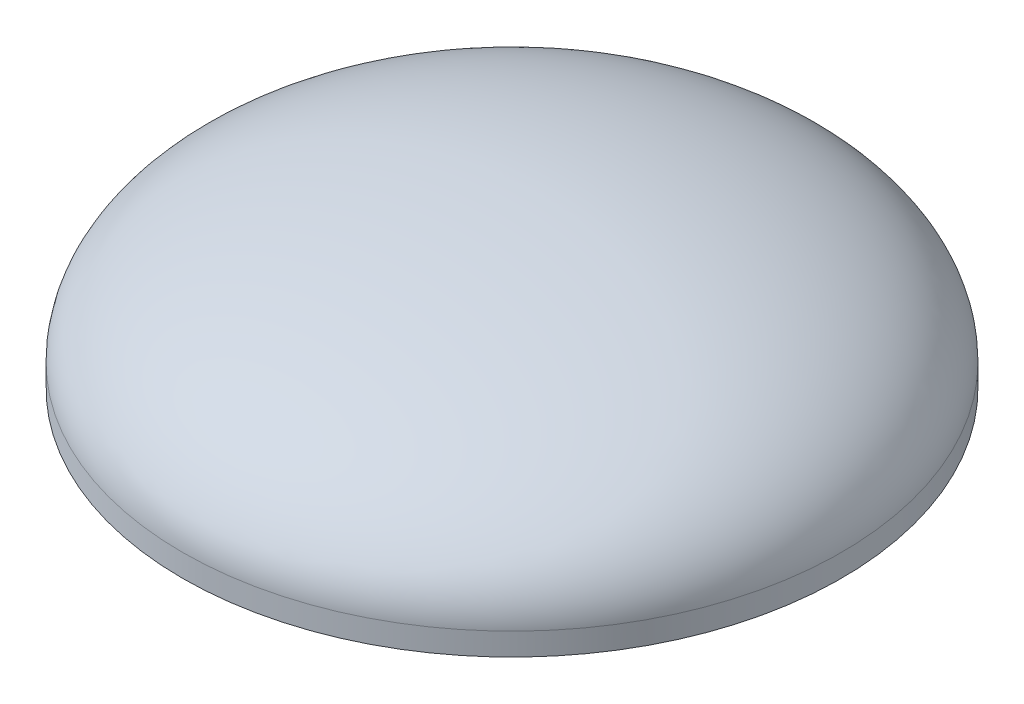
from build123d import *

# Parameters (mm, degrees)
SKETCH89_R          = 22
SKETCH89_R_2        = 20
BOSS_EXTRUDE1_DEPTH = 1.5


with BuildPart() as part:
    # Sketch89 → Boss-Extrude1 (new body)
    with BuildSketch(Plane(origin=(0, 32.096297607, 0), x_dir=(1, 0, 0), z_dir=(0, 1, 0))):
        with Locations(Location((-0.018821305, -3.312842377, 0), (0, 0, 270))):
            Circle(SKETCH89_R)
        with Locations(Location((-0.018821305, -3.312842377, 0), (0, 0, 270))):
            Circle(SKETCH89_R_2, mode=Mode.SUBTRACT)
    extrude(amount=BOSS_EXTRUDE1_DEPTH)

    # Sketch92 → Revolve1 (revolve)
    with BuildSketch(Plane(origin=(0.42839269, 0, 3.253965538), x_dir=(-0.9914448613738113, 0, 0.13052619222004508), z_dir=(-0.13052619222004508, 0, -0.9914448613738114)), mode=Mode.PRIVATE) as revolve1_sk:
        with BuildLine():
            add(Edge.make_bspline(
                [(22.451072987, 33.596297607), (22.451072987, 43.096297607), (0.451072987, 43.096297607)],
                knots=[3.141592654, 3.141592654, 3.141592654, 4.71238898, 4.71238898, 4.71238898], degree=2, weights=[1, 0.707106781, 1]))
            Line((0.451072987, 43.096297607), (0.451072987, 41.596297607))
            add(Edge.make_bspline(
                [(20.451072987, 33.596297607), (20.451072987, 41.596297607), (0.451072987, 41.596297607)],
                knots=[3.141592654, 3.141592654, 3.141592654, 4.71238898, 4.71238898, 4.71238898], degree=2, weights=[1, 0.707106781, 1]))
            Line((20.451072987, 33.596297607), (22.451072987, 33.596297607))
        make_face()
    revolve(revolve1_sk.sketch.rotate(Axis((-0.018821305, 46.361176327, 3.312842377), (0, -1, 0)), 7.5), axis=Axis((-0.018821305, 46.361176327, 3.312842377), (0, -1, 0)))


solid = part.part
